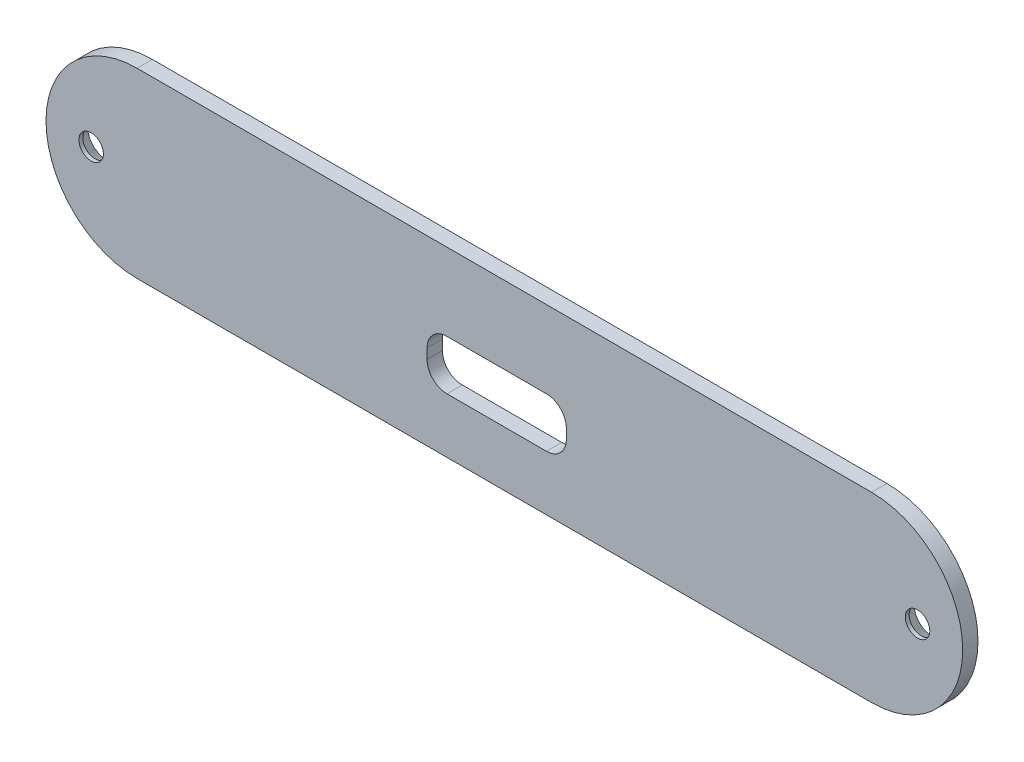
from build123d import *
from OCP.BRepFilletAPI import BRepFilletAPI_MakeChamfer

# Parameters (mm, degrees)
BOSS_EXTRUDE2_DEPTH = 1
SKETCH4_R           = 0.8
CUT_EXTRUDE1_DEPTH  = 31.551677532
SKETCH5_W           = 9.1
SKETCH5_H           = 3.25
CUT_EXTRUDE2_DEPTH  = 31.551677532
FILLET1_R           = 1.3
CHAMFER1_SIZE       = 0.75
CHAMFER1_SIZE2      = 0.433012702


with BuildPart() as part:
    # Sketch3 → Boss-Extrude2 (new body)
    with BuildSketch(Plane.XY):
        with BuildLine():
            Line((24, 5.95), (-24, 5.95))
            ThreePointArc((-24, 5.95), (-29.95, 0), (-24, -5.95))
            Line((-24, -5.95), (24, -5.95))
            ThreePointArc((24, -5.95), (29.95, 0), (24, 5.95))
        make_face()
    extrude(amount=BOSS_EXTRUDE2_DEPTH)

    # Sketch4 → Cut-Extrude1 (cut, through all)
    with BuildSketch(Plane.XY.offset(1)):
        with Locations((-27, 0)):
            Circle(SKETCH4_R)
        with Locations((27, 0)):
            Circle(SKETCH4_R)
    extrude(amount=-CUT_EXTRUDE1_DEPTH, mode=Mode.SUBTRACT)

    # Sketch5 → Cut-Extrude2 (cut, through all)
    with BuildSketch(Plane(origin=(0, 0, 0), x_dir=(-1, 0, 0), z_dir=(0, 0, -1))):
        with Locations((0.5, -0.725)):
            Rectangle(SKETCH5_W, SKETCH5_H)
    extrude(amount=-CUT_EXTRUDE2_DEPTH, mode=Mode.SUBTRACT)

    # Fillet1
    fillet1_edges = [part.edges().sort_by_distance(p)[0] for p in [
        (4.05, 0.9, 0.5),
        (-5.05, 0.9, 0.5),
        (4.05, -2.35, 0.5),
        (-5.05, -2.35, 0.5),
    ]]
    fillet(fillet1_edges, radius=FILLET1_R)

    # Chamfer1: one chamfer whose edges measure the first distance from different faces: ONE call of the kernel's chamfer builder (chamfer() names one face for all edges)
    chamfer1_edges_1 = [part.edges().sort_by_distance(p)[0] for p in [
        (26.2, 0, 0),
    ]]
    chamfer1_side_1 = [part.faces().sort_by_distance(p)[0] for p in [
        (26.2, 0, 0.5),
    ]]
    chamfer1_edges_2 = [part.edges().sort_by_distance(p)[0] for p in [
        (-27.8, 0, 0),
    ]]
    chamfer1_side_2 = [part.faces().sort_by_distance(p)[0] for p in [
        (-27.8, 0, 0.5),
    ]]
    chamfer1 = BRepFilletAPI_MakeChamfer(part.part.solid().wrapped)
    for e in chamfer1_edges_1:
        chamfer1.Add(CHAMFER1_SIZE, CHAMFER1_SIZE2, e.wrapped, chamfer1_side_1[0].wrapped)  # the first distance lies on this face
    for e in chamfer1_edges_2:
        chamfer1.Add(CHAMFER1_SIZE, CHAMFER1_SIZE2, e.wrapped, chamfer1_side_2[0].wrapped)  # the first distance lies on this face
    add(Compound.cast(chamfer1.Shape()), mode=Mode.REPLACE)


solid = part.part
